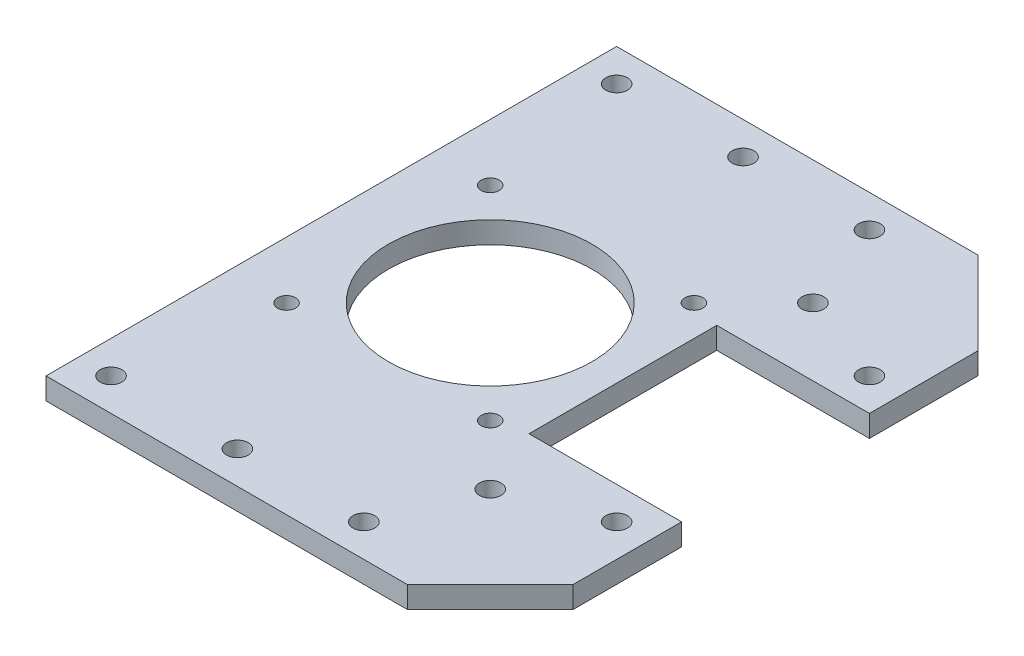
from build123d import *

# Parameters (mm, degrees)
SKETCH_1_R      = 1.5
SKETCH_1_R_2    = 1.25
SKETCH_1_R_3    = 14.1
EXTRUDE_1_DEPTH = 3


with BuildPart() as part:
    # 草图1 → 凸台-拉伸1 (new body)
    with BuildSketch(Plane(origin=(0, 0, 0), x_dir=(1, 0, 0), z_dir=(0, 1, 0))):
        Polygon((39.5, 13), (18.370549784, 12.991262473), (18.370549784, -13), (39.5, -13), (39.5, -28.031524747), (28.031524747, -39.5), (-22, -39.5), (-22, 30.5), (-22, 39.5), (28.031524747, 39.5), (39.5, 28.031524747), align=None)
        with Locations(Location((17.5, 35, 0), (0, 0, 270))):
            Circle(SKETCH_1_R, mode=Mode.SUBTRACT)
        with Locations(Location((22.337720199, 22.337720199, 0), (0, 0, 270))):
            Circle(SKETCH_1_R, mode=Mode.SUBTRACT)
        with Locations(Location((35, 17.5, 0), (0, 0, 270))):
            Circle(SKETCH_1_R, mode=Mode.SUBTRACT)
        with Locations(Location((17.5, -35, 0), (0, 0, 270))):
            Circle(SKETCH_1_R, mode=Mode.SUBTRACT)
        with Locations(Location((22.337720199, -22.337720199, 0), (0, 0, 270))):
            Circle(SKETCH_1_R, mode=Mode.SUBTRACT)
        with Locations(Location((35, -17.5, 0), (0, 0, 270))):
            Circle(SKETCH_1_R, mode=Mode.SUBTRACT)
        with Locations(Location((-14.1, 14.1, 0), (0, 0, 270))):
            Circle(SKETCH_1_R_2, mode=Mode.SUBTRACT)
        with Locations(Location((14.1, -14.1, 0), (0, 0, 270))):
            Circle(SKETCH_1_R_2, mode=Mode.SUBTRACT)
        with Locations(Location((0, 35, 0), (0, 0, 270))):
            Circle(SKETCH_1_R, mode=Mode.SUBTRACT)
        with Locations(Location((-17.5, 35, 0), (0, 0, 270))):
            Circle(SKETCH_1_R, mode=Mode.SUBTRACT)
        with Locations(Location((0, -35, 0), (0, 0, 90))):
            Circle(SKETCH_1_R, mode=Mode.SUBTRACT)
        with Locations(Location((-17.5, -35, 0), (0, 0, 90))):
            Circle(SKETCH_1_R, mode=Mode.SUBTRACT)
        with Locations(Location((14.1, 14.1, 0), (0, 0, 270))):
            Circle(SKETCH_1_R_2, mode=Mode.SUBTRACT)
        with Locations(Location((-14.1, -14.1, 0), (0, 0, 270))):
            Circle(SKETCH_1_R_2, mode=Mode.SUBTRACT)
        with Locations(Location((0, 0, 0), (0, 0, 270))):
            Circle(SKETCH_1_R_3, mode=Mode.SUBTRACT)
    extrude(amount=EXTRUDE_1_DEPTH)


solid = part.part
